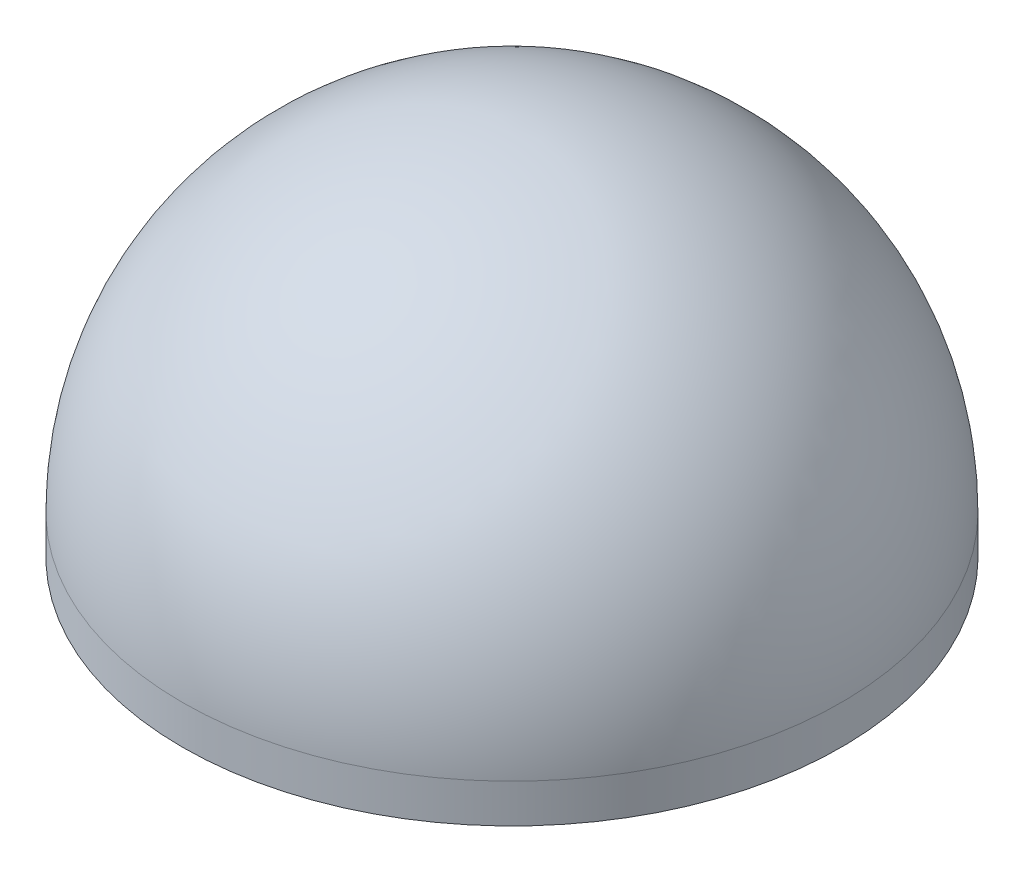
from build123d import *

# Parameters (mm, degrees)
SKETCH1_R           = 17
BOSS_EXTRUDE1_DEPTH = 2
REVOLVE1_ANGLE      = 180
SKETCH3_R           = 11
CUT_EXTRUDE1_DEPTH  = 4


with BuildPart() as part:
    # Sketch1 → Boss-Extrude1 (new body)
    with BuildSketch(Plane(origin=(0, 0, 0), x_dir=(1, 0, 0), z_dir=(0, 1, 0))):
        with Locations(Location((0, 0, 0), (0, 0, 270))):
            Circle(SKETCH1_R)
    extrude(amount=BOSS_EXTRUDE1_DEPTH)

    # Sketch2 → Revolve1 (revolve)
    with BuildSketch(Plane(origin=(0, 2, 0), x_dir=(1, 0, 0), z_dir=(0, 1, 0))):
        with BuildLine():
            Line((-17, 0), (17, 0))
            ThreePointArc((17, 0), (0, 17), (-17, 0))
        make_face()
    revolve(axis=Axis((-17, 2, 0), (1, 0, 0)), revolution_arc=REVOLVE1_ANGLE)

    # Sketch3 → Cut-Extrude1 (cut)
    with BuildSketch(Plane.XZ):
        with Locations(Location((0, 0, 0), (0, 0, 270))):
            Circle(SKETCH3_R)
    extrude(amount=-CUT_EXTRUDE1_DEPTH, mode=Mode.SUBTRACT)


solid = part.part
